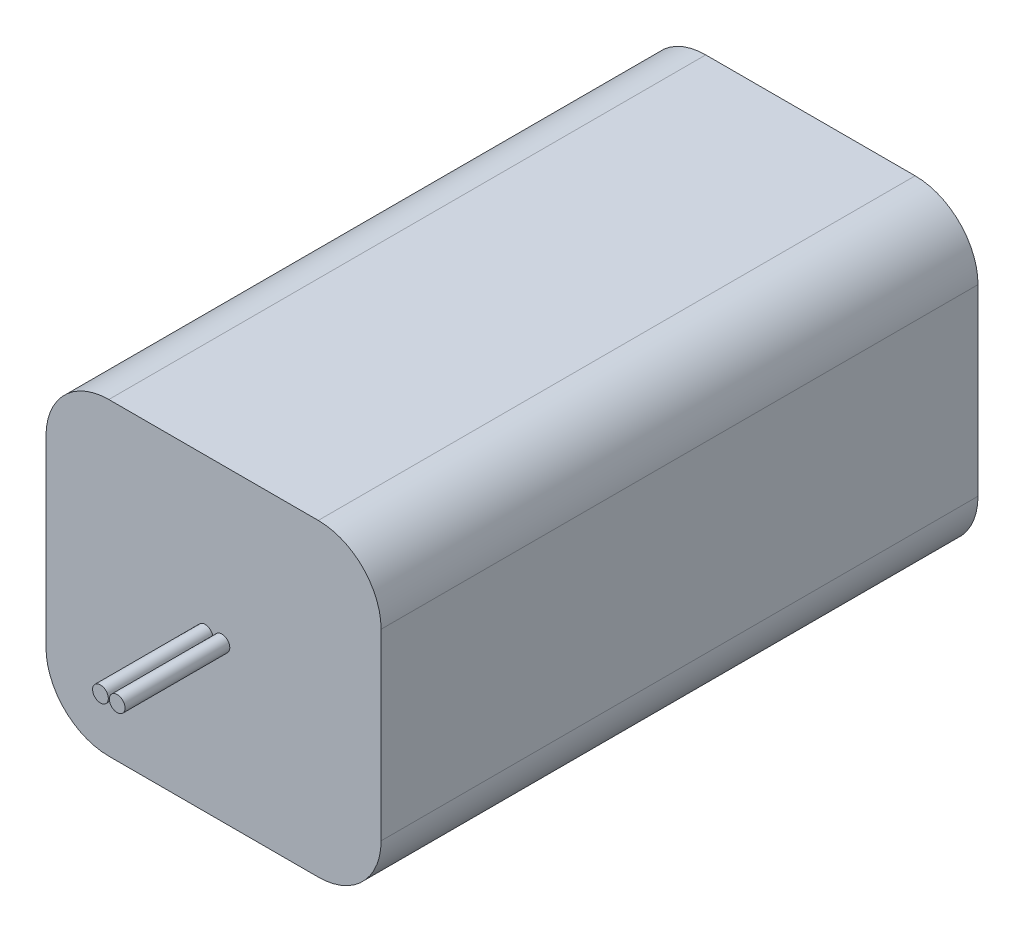
from build123d import *

# Parameters (mm, degrees)
ESQUISSE1_W          = 32
ESQUISSE1_H          = 29.5
BOSS_EXTRU_1_DEPTH   = 28.5
CONG_1_R             = 6
ESQUISSE2_R          = 0.75
BOSS_EXTRU_2_DEPTH   = 10
BOSS_EXTRU_2_2_DEPTH = 10


with BuildPart() as part:
    # Esquisse1 → Boss.-Extru.1 (new, symmetric)
    with BuildSketch(Plane.XY):
        Rectangle(ESQUISSE1_W, ESQUISSE1_H)
    extrude(amount=BOSS_EXTRU_1_DEPTH, both=True)

    # Congé1
    cong_1_edges = [part.edges().sort_by_distance(p)[0] for p in [
        (-16, 14.75, 0),
        (16, 14.75, 0),
        (16, -14.75, 0),
        (-16, -14.75, 0),
    ]]
    fillet(cong_1_edges, radius=CONG_1_R)


with BuildPart() as body_2:
    # Esquisse2 → Boss.-Extru.2 (new body)
    with BuildSketch(Plane.XY.offset(28.5)):
        with Locations((-0.8, 0)):
            Circle(ESQUISSE2_R)
    extrude(amount=BOSS_EXTRU_2_DEPTH)


with BuildPart() as body_3:
    # Esquisse2 → Boss.-Extru.2 2 (new body)
    with BuildSketch(Plane.XY.offset(28.5)):
        with Locations((0.8, 0)):
            Circle(ESQUISSE2_R)
    extrude(amount=BOSS_EXTRU_2_2_DEPTH)


solid = Compound([part.part, body_2.part, body_3.part])
